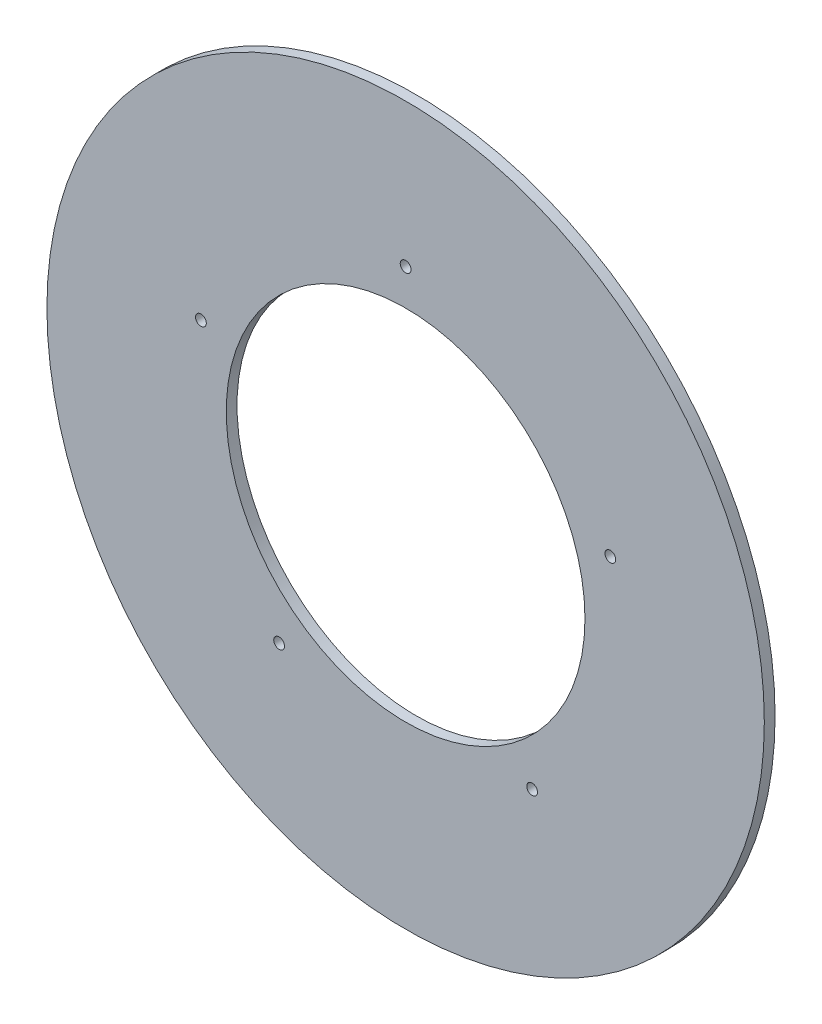
from build123d import *

# Parameters (mm, degrees)
SKETCH1_R           = 50
SKETCH1_R_2         = 25
BOSS_EXTRUDE1_DEPTH = 1.5
SKETCH2_R           = 0.75
CUT_EXTRUDE1_DEPTH  = 71.726586232


with BuildPart() as part:
    # Sketch1 → Boss-Extrude1 (new body)
    with BuildSketch(Plane.XY):
        Circle(SKETCH1_R)
        Circle(SKETCH1_R_2, mode=Mode.SUBTRACT)
    extrude(amount=BOSS_EXTRUDE1_DEPTH)

    # Sketch2 → Cut-Extrude1 (cut, through all)
    with BuildSketch(Plane.XY.offset(1.5)):
        with Locations((0, 30)):
            Circle(SKETCH2_R)
        with Locations((28.531695489, 9.270509831)):
            Circle(SKETCH2_R)
        with Locations((17.633557569, -24.270509831)):
            Circle(SKETCH2_R)
        with Locations((-17.633557569, -24.270509831)):
            Circle(SKETCH2_R)
        with Locations((-28.531695489, 9.270509831)):
            Circle(SKETCH2_R)
    extrude(amount=-CUT_EXTRUDE1_DEPTH, mode=Mode.SUBTRACT)


solid = part.part
